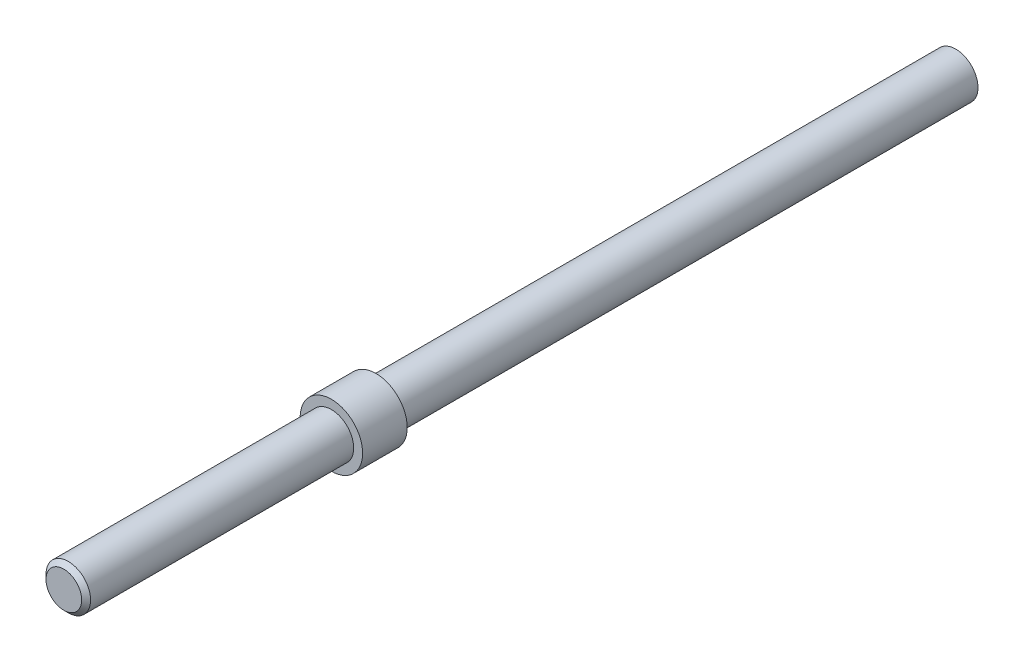
from build123d import *

# Parameters (mm, degrees)
SKETCH1_R           = 5
BOSS_EXTRUDE1_DEPTH = 200
CHAMFER1_SIZE       = 1
SKETCH2_R           = 7
BOSS_EXTRUDE2_DEPTH = 5


with BuildPart() as part:
    # Sketch1 → Boss-Extrude1 (new body)
    with BuildSketch(Plane.XY):
        Circle(SKETCH1_R)
    extrude(amount=BOSS_EXTRUDE1_DEPTH)

    # Chamfer1
    chamfer1_edges = [part.edges().sort_by_distance(p)[0] for p in [
        (-5, 0, 200),
    ]]
    chamfer(chamfer1_edges, length=CHAMFER1_SIZE)

    # Sketch2 → Boss-Extrude2 (add, symmetric)
    with BuildSketch(Plane.XY.offset(135)):
        Circle(SKETCH2_R)
    extrude(amount=BOSS_EXTRUDE2_DEPTH, both=True)


solid = part.part
